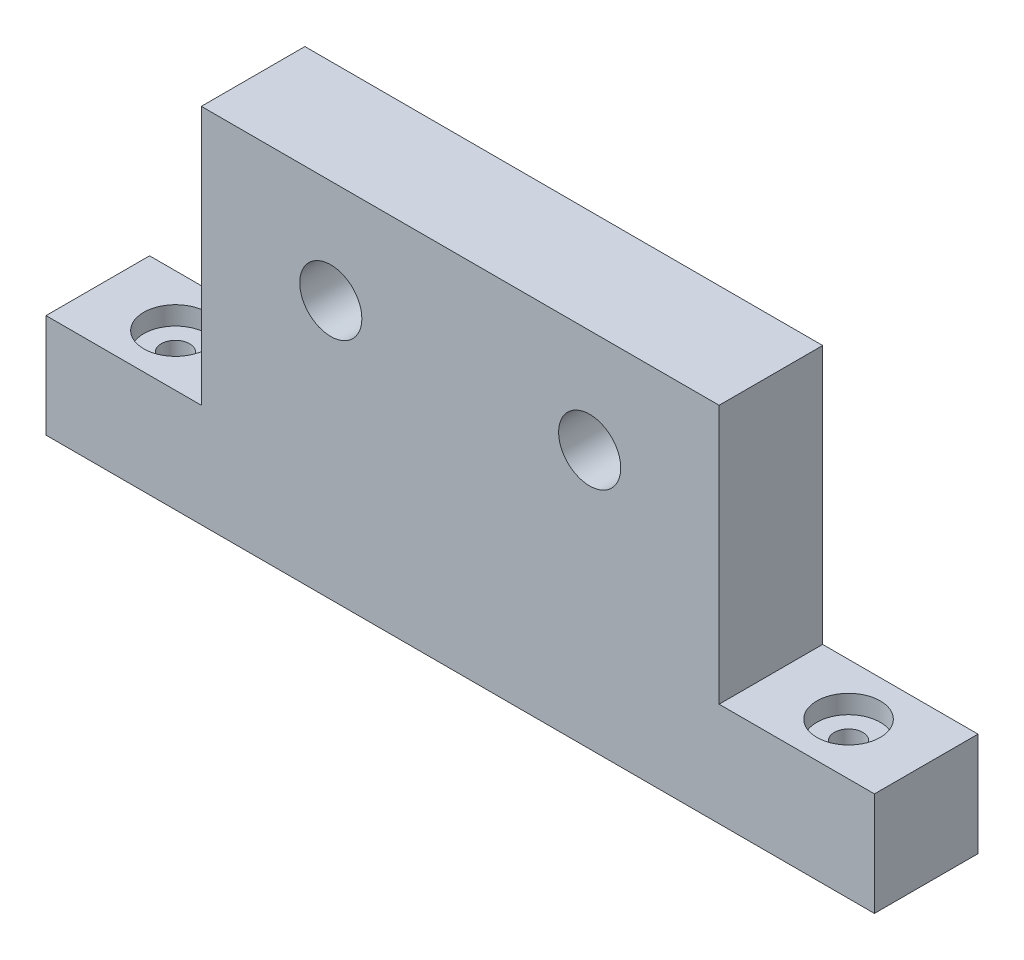
from build123d import *

# Parameters (mm, degrees)
SKETCH2_R              = 6
CORPO_FUROS_12MM_DEPTH = 20
FUROS_6MM_D            = 5.5
FUROS_6MM_CBORE_D      = 12.24
FUROS_6MM_CBORE_DEPTH  = 3.58


with BuildPart() as part:
    # Sketch2 → Corpo - Furos 12mm (new body)
    with BuildSketch(Plane.XY):
        Polygon((80, 0), (-80, 0), (-80, 20), (-50, 20), (-50, 70), (0, 70), (50, 70), (50, 20), (80, 20), align=None)
        with Locations((-25, 50)):
            Circle(SKETCH2_R, mode=Mode.SUBTRACT)
        with Locations(Location((25, 50, 0), (0, 0, 180))):
            Circle(SKETCH2_R, mode=Mode.SUBTRACT)
    extrude(amount=CORPO_FUROS_12MM_DEPTH)

    # Furos Ø6mm (through all)
    with Locations(Plane(origin=(0, 20, 0), x_dir=(1, 0, 0), z_dir=(0, 1, 0))):
        with Locations((-65, -10), (65, -10)):
            CounterBoreHole(FUROS_6MM_D / 2, FUROS_6MM_CBORE_D / 2, FUROS_6MM_CBORE_DEPTH)


solid = part.part
